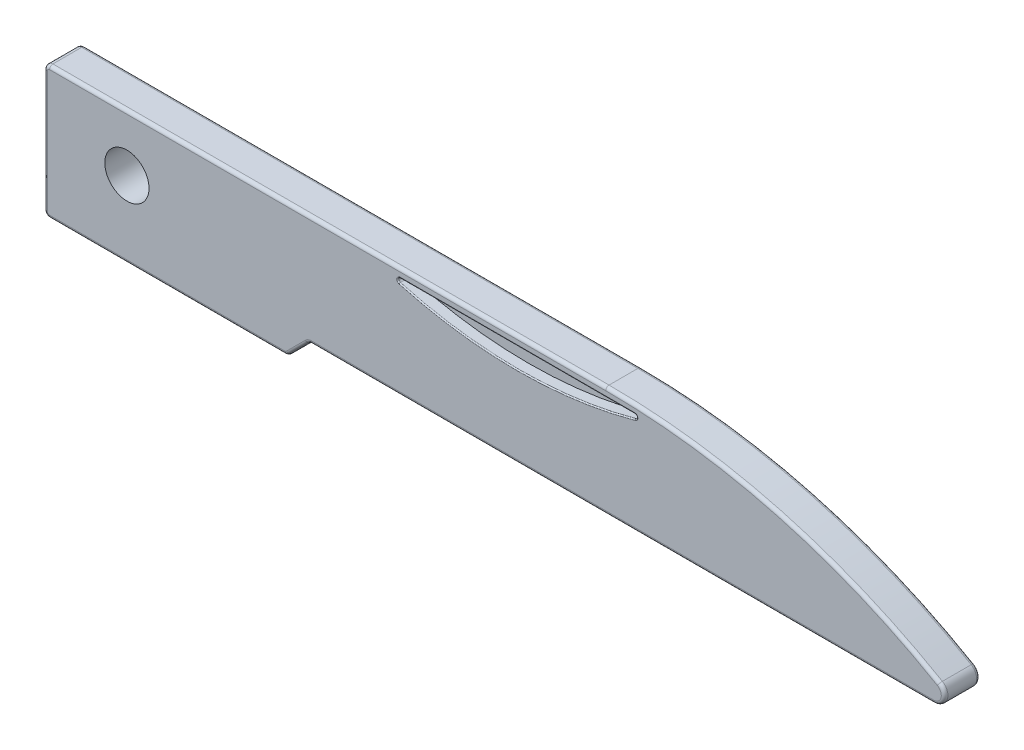
from build123d import *

# Parameters (mm, degrees)
BOSS_EXTRUDE1_DEPTH = 1.6
FILLET1_R           = 0.5
FILLET2_R           = 0.25
FILLET3_R           = 0.15
SKETCH2_R           = 1
CUT_EXTRUDE1_DEPTH  = 42.21969505
CUT_EXTRUDE2_DEPTH  = 0.5
FILLET4_R           = 0.1
FILLET5_R           = 0.05


with BuildPart() as part:
    # Sketch1 → Boss-Extrude1 (new body)
    with BuildSketch(Plane.XY):
        with BuildLine():
            Line((0, 0), (0, 6))
            Line((0, 6), (25.416876048, 6))
            ThreePointArc((25.416876048, 6), (34.077130086, 4.722813233), (42, 1))
            Line((42, 1), (12, 1))
            Line((12, 1), (11, 0))
            Line((11, 0), (0, 0))
        make_face()
    extrude(amount=BOSS_EXTRUDE1_DEPTH)

    # Fillet1
    fillet1_edges = [part.edges().sort_by_distance(p)[0] for p in [
        (42, 1, 0.8),
    ]]
    fillet(fillet1_edges, radius=FILLET1_R)

    # Fillet2
    fillet2_edges = [part.edges().sort_by_distance(p)[0] for p in [
        (0, 0, 0.8),
        (0, 6, 0.8),
        (12, 1, 0.8),
        (11, 0, 0.8),
    ]]
    fillet(fillet2_edges, radius=FILLET2_R)

    # Fillet3
    fillet3_edges = [part.edges().sort_by_distance(p)[0] for p in [
        (33.228210707, 4.96520414, 0),
        (33.228210707, 4.96520414, 1.6),
        (12.833438024, 6, 1.6),
        (40.732026425, 1.369811089, 0),
        (40.732026425, 1.369811089, 1.6),
        (0, 3, 0),
        (0, 3, 1.6),
        (26.176413207, 1, 0),
        (11.5, 0.5, 0),
        (5.573223305, 0, 0),
        (0.073223305, 0.073223305, 0),
        (10.992117467, 0.019030117, 0),
        (0.073223305, 5.926776695, 0),
        (26.176413207, 1, 1.6),
        (5.573223305, 0, 1.6),
        (11.5, 0.5, 1.6),
        (0.073223305, 0.073223305, 1.6),
        (10.992117467, 0.019030117, 1.6),
        (0.073223305, 5.926776695, 1.6),
        (12.007882533, 0.980969883, 0),
        (12.007882533, 0.980969883, 1.6),
        (12.833438024, 6, 0),
    ]]
    fillet(fillet3_edges, radius=FILLET3_R)

    # Sketch2 → Cut-Extrude1 (cut, through all)
    with BuildSketch(Plane.XY.offset(1.6)):
        with Locations((3.75, 3.45)):
            Circle(SKETCH2_R)
    extrude(amount=-CUT_EXTRUDE1_DEPTH, mode=Mode.SUBTRACT)

    # Sketch3 → Cut-Extrude2 (cut)
    with BuildSketch(Plane.XY.offset(1.6)):
        with BuildLine():
            Line((15.416876048, 5.6), (27.416876048, 5.6))
            ThreePointArc((27.416876048, 5.6), (21.416876048, 4.678784028), (15.416876048, 5.6))
        make_face()
    extrude(amount=-CUT_EXTRUDE2_DEPTH, mode=Mode.SUBTRACT)

    # Fillet4
    fillet4_edges = [part.edges().sort_by_distance(p)[0] for p in [
        (27.416876048, 5.6, 1.35),
        (15.416876048, 5.6, 1.35),
    ]]
    fillet(fillet4_edges, radius=FILLET4_R)

    # Fillet5
    fillet5_edges = [part.edges().sort_by_distance(p)[0] for p in [
        (21.416876048, 5.6, 1.6),
        (21.416876048, 4.678784028, 1.6),
        (26.824849278, 5.513461428, 1.6),
        (16.008902818, 5.513461428, 1.6),
    ]]
    fillet(fillet5_edges, radius=FILLET5_R)


solid = part.part
